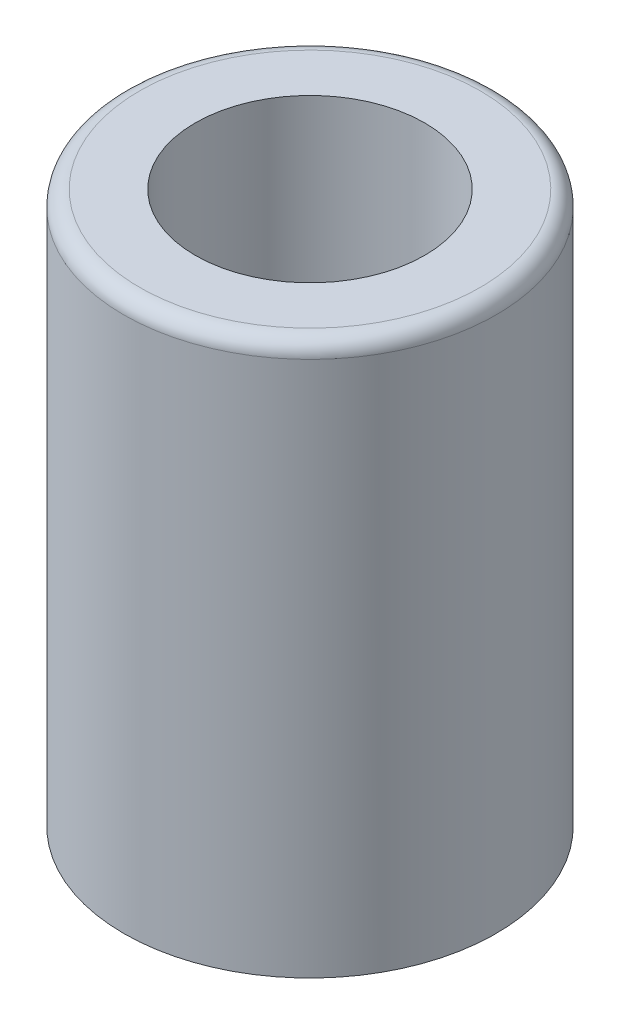
from build123d import *

# Parameters (mm, degrees)
FILLET1_R = 0.3


with BuildPart() as part:
    # Sketch2 → Revolve1 (revolve)
    with BuildSketch(Plane.XY, mode=Mode.PRIVATE) as revolve1_sk:
        Polygon((0, 0), (3.52, 0), (3.52, 10.43), (2.17, 10.43), (2.17, 3.805590511), (0, 3.805590511), align=None)
    revolve(revolve1_sk.sketch.rotate(Axis((0, 3.805590511, 0), (0, -1, 0)), 90), axis=Axis((0, 3.805590511, 0), (0, -1, 0)))

    # Fillet1
    fillet1_edges = [part.edges().sort_by_distance(p)[0] for p in [
        (0, 10.43, -3.52),
    ]]
    fillet(fillet1_edges, radius=FILLET1_R)


solid = part.part
